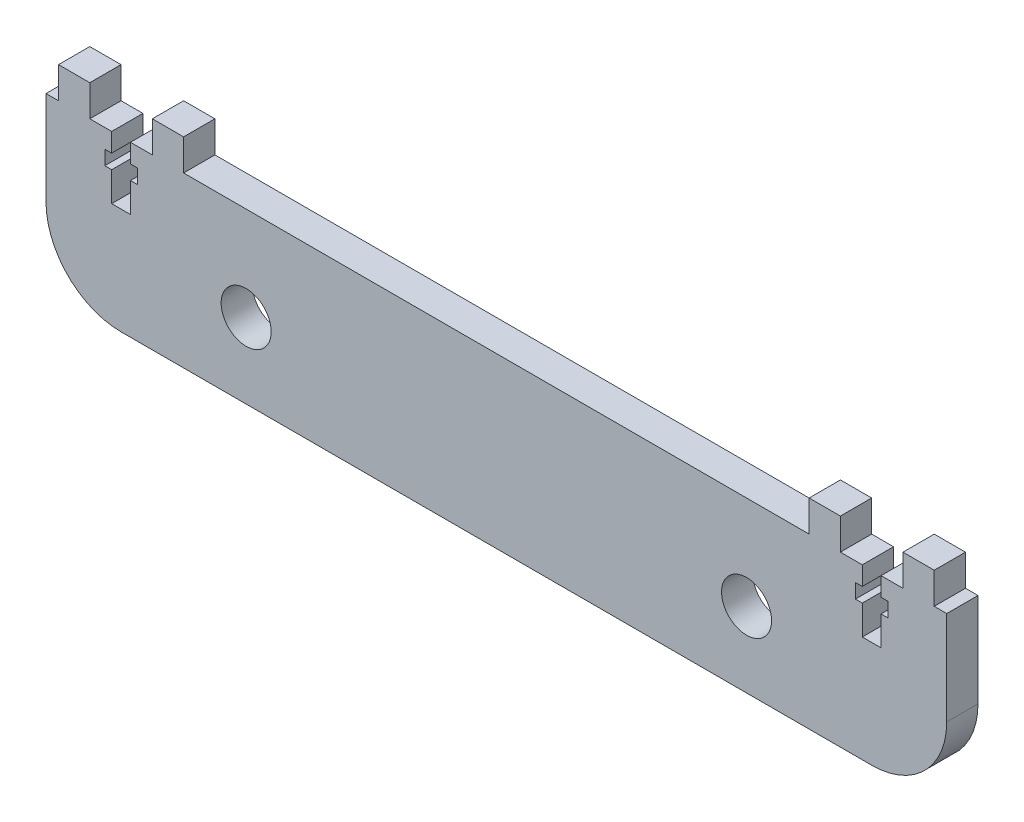
from build123d import *

# Parameters (mm, degrees)
SKETCH1_R           = 4
SKETCH1_W           = 5
SKETCH1_H           = 5
BOSS_EXTRUDE2_DEPTH = 5


with BuildPart() as part:
    # Sketch1 → Boss-Extrude2 (new body)
    # profile 1 of 5: a face of its own
    with BuildSketch(Plane.XY):
        with BuildLine():
            Line((-72, 15), (-72, 0))
            ThreePointArc((-72, 0), (-68.485281374, -8.485281374), (-60, -12))
            Line((-60, -12), (60, -12))
            ThreePointArc((60, -12), (68.485281374, -8.485281374), (72, 0))
            Line((72, 0), (72, 15))
            Line((72, 15), (70, 15))
            Line((70, 15), (65, 15))
            Line((65, 15), (61.5, 15))
            Line((61.5, 15), (61.5, 12))
            Line((61.5, 12), (62.6, 12))
            Line((62.6, 12), (62.6, 9.7))
            Line((62.6, 9.7), (61.5, 9.7))
            Line((61.5, 9.7), (61.5, 5))
            Line((61.5, 5), (58.5, 5))
            Line((58.5, 5), (58.5, 9.7))
            Line((58.5, 9.7), (57.4, 9.7))
            Line((57.4, 9.7), (57.4, 12))
            Line((57.4, 12), (58.5, 12))
            Line((58.5, 12), (58.5, 15))
            Line((58.5, 15), (55, 15))
            Line((55, 15), (50, 15))
            Line((50, 15), (-50, 15))
            Line((-50, 15), (-55, 15))
            Line((-55, 15), (-58.5, 15))
            Line((-58.5, 15), (-58.5, 12))
            Line((-58.5, 12), (-57.4, 12))
            Line((-57.4, 12), (-57.4, 9.7))
            Line((-57.4, 9.7), (-58.5, 9.7))
            Line((-58.5, 9.7), (-58.5, 5))
            Line((-58.5, 5), (-61.5, 5))
            Line((-61.5, 5), (-61.5, 9.7))
            Line((-61.5, 9.7), (-62.6, 9.7))
            Line((-62.6, 9.7), (-62.6, 12))
            Line((-62.6, 12), (-61.5, 12))
            Line((-61.5, 12), (-61.5, 15))
            Line((-61.5, 15), (-65, 15))
            Line((-65, 15), (-70, 15))
            Line((-70, 15), (-72, 15))
        make_face()
        with Locations((-40, 0)):
            Circle(SKETCH1_R, mode=Mode.SUBTRACT)
        with Locations((40, 0)):
            Circle(SKETCH1_R, mode=Mode.SUBTRACT)
    # profile 2 of 5: a face of its own
    with BuildSketch(Plane.XY):
        with Locations((52.5, 17.5)):
            Rectangle(SKETCH1_W, SKETCH1_H)
    # profile 3 of 5: a face of its own
    with BuildSketch(Plane.XY):
        with Locations((67.5, 17.5)):
            Rectangle(SKETCH1_W, SKETCH1_H)
    # profile 4 of 5: a face of its own
    with BuildSketch(Plane.XY):
        with Locations((-67.5, 17.5)):
            Rectangle(SKETCH1_W, SKETCH1_H)
    # profile 5 of 5: a face of its own
    with BuildSketch(Plane.XY):
        with Locations((-52.5, 17.5)):
            Rectangle(SKETCH1_W, SKETCH1_H)
    extrude(amount=BOSS_EXTRUDE2_DEPTH)


solid = part.part
